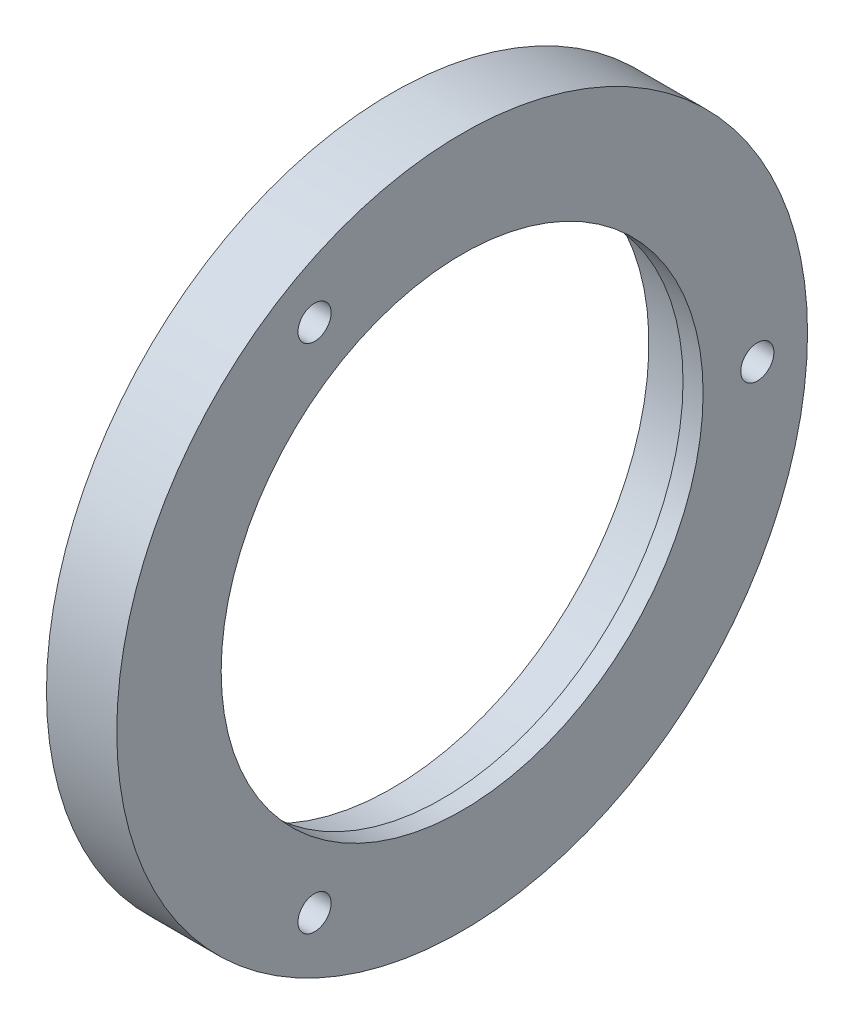
from build123d import *

# Parameters (mm, degrees)
AXIAL_HOLES_DEPTH      = 184.274684558
AXIAL_HOLES_DEPTH_BACK = 184.274684558
SKETCH2_R              = 1.65
CUT_EXTRUDE2_START     = 174
SKETCH3_R              = 3
CUT_EXTRUDE2_DEPTH     = 2.7


with BuildPart() as part:
    # Axial profile (mm) → Full revolution (revolve)
    with BuildSketch(Plane.XY, mode=Mode.PRIVATE) as full_revolution_sk:
        Polygon((169.7, 25.6), (174.7, 25.6), (174.7, 24), (176.7, 24), (176.7, 34.4), (169.7, 34.4), align=None)
    revolve(full_revolution_sk.sketch.rotate(Axis((-110, 0, 0), (1, 0, 0)), 90), axis=Axis((-110, 0, 0), (1, 0, 0)))

    # Sketch2 → Axial holes (cut, two sides: drawn at the far end of the back side and taken through both)
    with BuildSketch(Plane(origin=(0, 0, 0), x_dir=(0, 0, -1), z_dir=(1, 0, 0)).offset(-AXIAL_HOLES_DEPTH_BACK)):
        with Locations(Location((29.4, 0, 0), (0, 0, 180))):
            Circle(SKETCH2_R)
        with Locations(Location((-14.7, 25.461146871, 0), (0, 0, 180))):
            Circle(SKETCH2_R)
        with Locations(Location((-14.7, -25.461146871, 0), (0, 0, 180))):
            Circle(SKETCH2_R)
    extrude(amount=AXIAL_HOLES_DEPTH + AXIAL_HOLES_DEPTH_BACK, mode=Mode.SUBTRACT)

    # Sketch3 → Cut-Extrude2 (cut)
    with BuildSketch(Plane(origin=(0, 0, 0), x_dir=(0, 0, -1), z_dir=(1, 0, 0)).offset(CUT_EXTRUDE2_START)):
        with Locations((29.4, 0)):
            Circle(SKETCH3_R)
        with Locations((-14.7, 25.461146871)):
            Circle(SKETCH3_R)
        with Locations((-14.7, -25.461146871)):
            Circle(SKETCH3_R)
    extrude(amount=-CUT_EXTRUDE2_DEPTH, mode=Mode.SUBTRACT)


solid = part.part
